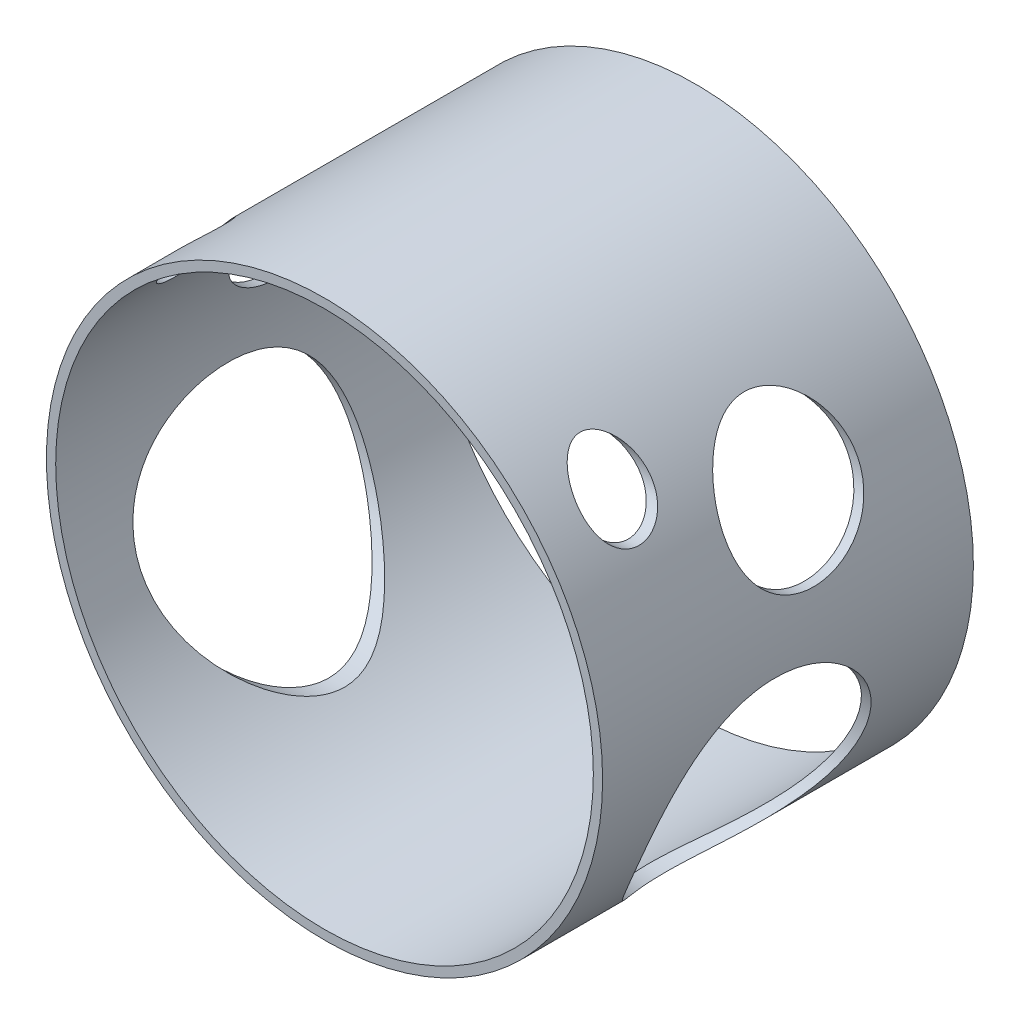
from build123d import *

# Parameters (mm, degrees)
SKETCH2_R               = 45
SKETCH2_R_2             = 43.5
BOSS_EXTRUDE2_DEPTH     = 60
CUT_EXTRUDE2_DEPTH      = 50
CUT_EXTRUDE2_DEPTH_BACK = 50
SKETCH15_R              = 18.066225037
CUT_EXTRUDE3_DEPTH      = 50
CUT_EXTRUDE3_DEPTH_BACK = 50
SKETCH16_R              = 5.555805237
SKETCH16_R_2            = 10.86229577


with BuildPart() as part:
    # Sketch2 → Boss-Extrude2 (new body)
    with BuildSketch(Plane.XY):
        with Locations((0, 1.149765989)):
            Circle(SKETCH2_R)
        with Locations((0, 1.149765989)):
            Circle(SKETCH2_R_2, mode=Mode.SUBTRACT)
    extrude(amount=BOSS_EXTRUDE2_DEPTH)

    # Sketch15 → Cut-Extrude2 (cut, two sides: drawn at the far end of the back side and taken through both)
    with BuildSketch(Plane(origin=(0, 0, 0), x_dir=(0, 0, -1), z_dir=(1, 0, 0)).offset(-CUT_EXTRUDE2_DEPTH_BACK)):
        with Locations((-32.064322289, -16.615916737)):
            Circle(SKETCH15_R)
    extrude(amount=CUT_EXTRUDE2_DEPTH + CUT_EXTRUDE2_DEPTH_BACK, mode=Mode.SUBTRACT)

    # Sketch16 → Cut-Extrude3 (cut, two sides: drawn at the far end of the back side and taken through both)
    with BuildSketch(Plane(origin=(0, 0, 0), x_dir=(0, 0, -1), z_dir=(1, 0, 0)).offset(-CUT_EXTRUDE3_DEPTH_BACK)):
        with Locations((-47.578017063, 30.05027803)):
            Circle(SKETCH16_R)
        with Locations((-24.93302711, 21.042326225)):
            Circle(SKETCH16_R_2)
    extrude(amount=CUT_EXTRUDE3_DEPTH + CUT_EXTRUDE3_DEPTH_BACK, mode=Mode.SUBTRACT)


solid = part.part
